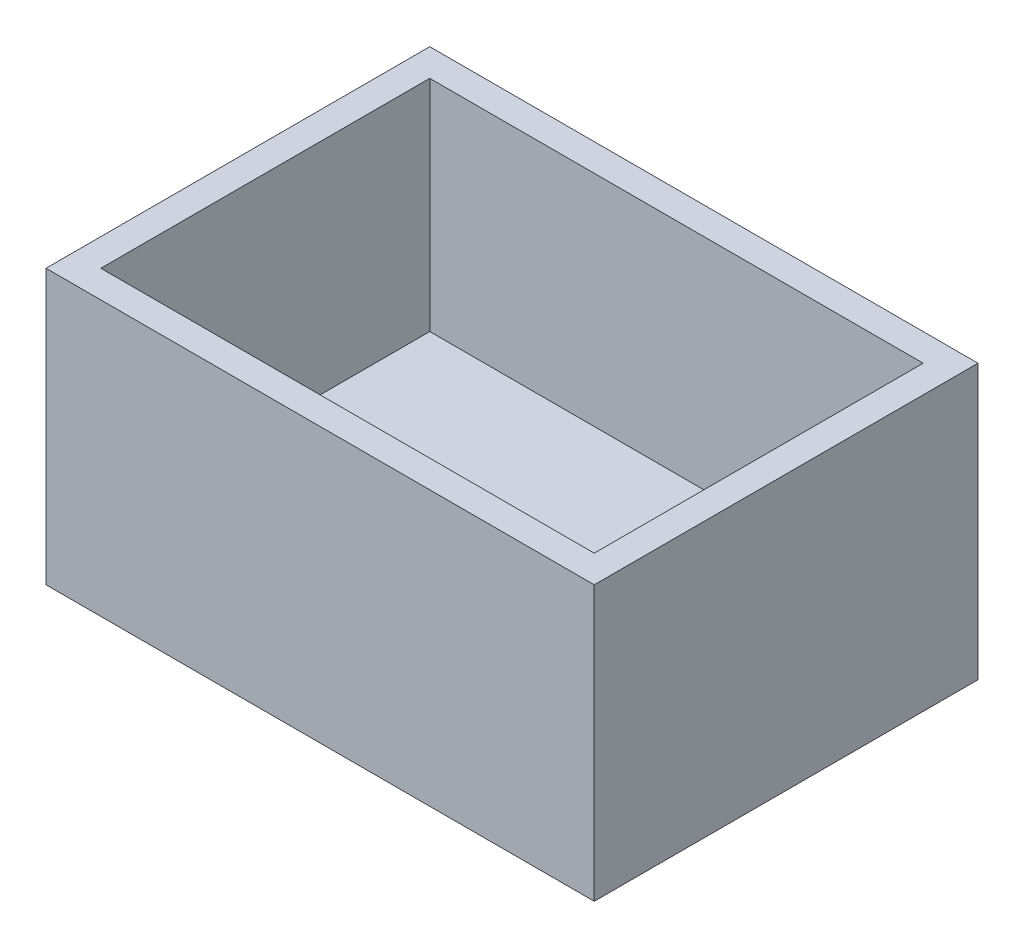
from build123d import *

# Parameters (mm, degrees)
SKETCH1_W           = 254
SKETCH1_H           = 177.8
BOSS_EXTRUDE1_DEPTH = 127
SKETCH2_W           = 228.6
SKETCH2_H           = 152.4
CUT_EXTRUDE1_DEPTH  = 101.6


with BuildPart() as part:
    # Sketch1 → Boss-Extrude1 (new body)
    with BuildSketch(Plane(origin=(0, 0, 0), x_dir=(1, 0, 0), z_dir=(0, 1, 0))):
        Rectangle(SKETCH1_W, SKETCH1_H)
    extrude(amount=BOSS_EXTRUDE1_DEPTH)

    # Sketch2 → Cut-Extrude1 (cut)
    with BuildSketch(Plane(origin=(0, 127, 0), x_dir=(1, 0, 0), z_dir=(0, 1, 0))):
        Rectangle(SKETCH2_W, SKETCH2_H)
    extrude(amount=-CUT_EXTRUDE1_DEPTH, mode=Mode.SUBTRACT)


solid = part.part
